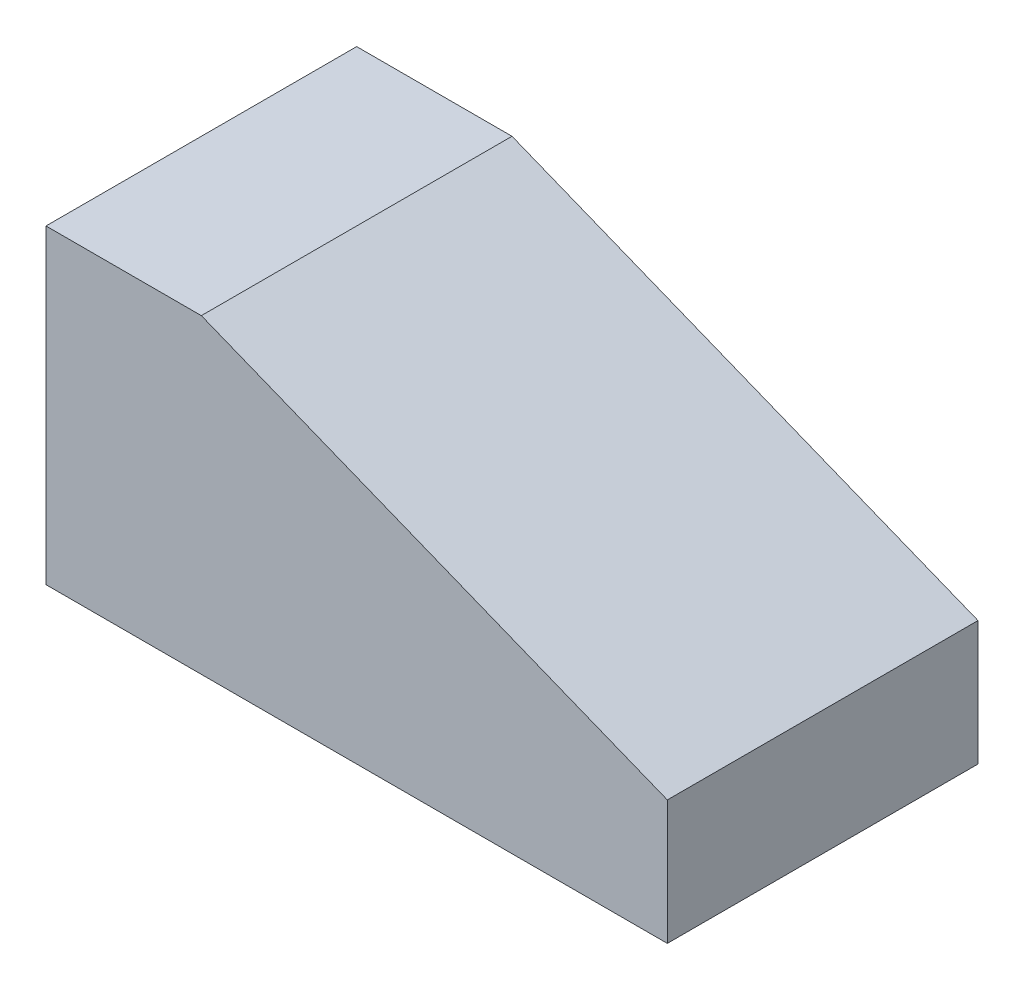
from build123d import *

# Parameters (mm, degrees)
BOSS_EXTRUDE1_DEPTH = 50


with BuildPart() as part:
    # Sketch2 → Boss-Extrude1 (new body)
    with BuildSketch(Plane.XY):
        Polygon((0, 0), (100, 0), (100, 20), (25, 50), (0, 50), align=None)
    extrude(amount=BOSS_EXTRUDE1_DEPTH)


solid = part.part
